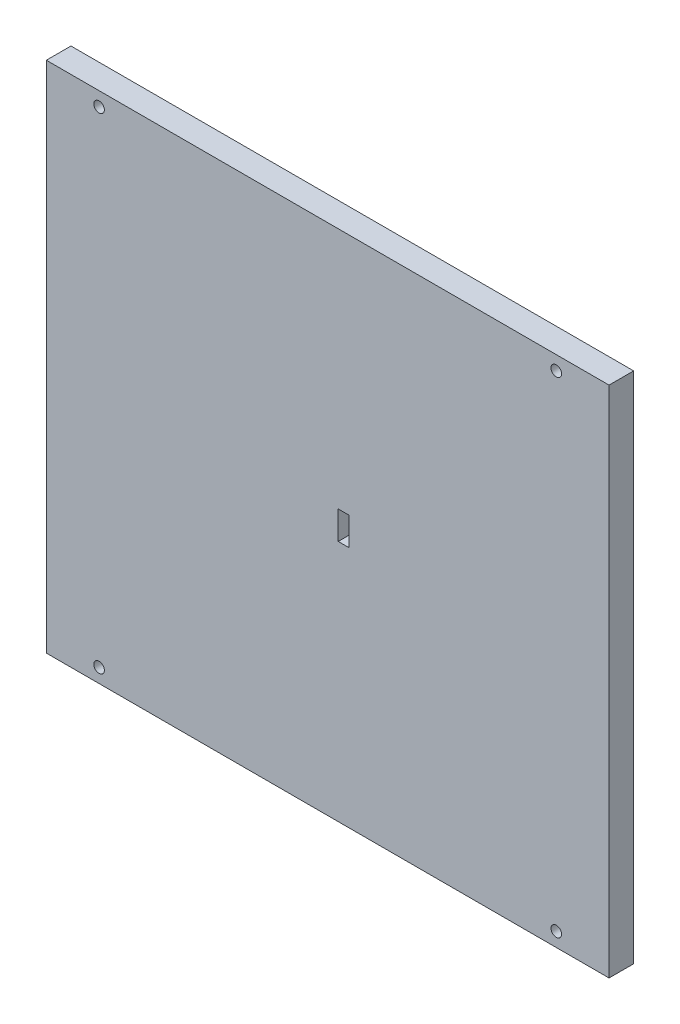
from build123d import *

# Parameters (mm, degrees)
SCHIZZO1_W                   = 160
SCHIZZO1_H                   = 146
SCHIZZO1_R                   = 1.5
ESTRUSIONE_ESTRUSIONE1_DEPTH = 7
SCHIZZO2_W                   = 35
SCHIZZO2_H                   = 24
SCHIZZO2_W_2                 = 23
SCHIZZO2_H_2                 = 12
ESTRUSIONE_ESTRUSIONE2_DEPTH = 13.5
SCHIZZO3_R                   = 1
TAGLIO_ESTRUSIONE1_DEPTH     = 5
SCHIZZO4_R                   = 40
SCHIZZO4_R_2                 = 36.5
ESTRUSIONE_ESTRUSIONE3_DEPTH = 28.5
RACCORDO1_R                  = 10
SCHIZZO5_W                   = 3
SCHIZZO5_H                   = 8
TAGLIO_ESTRUSIONE2_DEPTH     = 41


with BuildPart() as part:
    # Schizzo1 → Estrusione-Estrusione1 (new body)
    with BuildSketch(Plane.XY):
        with Locations((-3.483874863, 6.01)):
            Rectangle(SCHIZZO1_W, SCHIZZO1_H)
        with Locations((-68.483874863, 75.01)):
            Circle(SCHIZZO1_R, mode=Mode.SUBTRACT)
        with Locations((61.516125137, 75.01)):
            Circle(SCHIZZO1_R, mode=Mode.SUBTRACT)
        with Locations((-68.483874863, -62.99)):
            Circle(SCHIZZO1_R, mode=Mode.SUBTRACT)
        with Locations((61.516125137, -62.99)):
            Circle(SCHIZZO1_R, mode=Mode.SUBTRACT)
    extrude(amount=ESTRUSIONE_ESTRUSIONE1_DEPTH)

    # Schizzo2 → Estrusione-Estrusione2 (add)
    with BuildSketch(Plane(origin=(0, 0, 0), x_dir=(-1, 0, 0), z_dir=(0, 0, -1))):
        with Locations((8.983874863, 6.01)):
            Rectangle(SCHIZZO2_W, SCHIZZO2_H)
        with Locations((8.983874863, 6.01)):
            Rectangle(SCHIZZO2_W_2, SCHIZZO2_H_2, mode=Mode.SUBTRACT)
    extrude(amount=ESTRUSIONE_ESTRUSIONE2_DEPTH)

    # Schizzo3 → Taglio-Estrusione1 (cut)
    with BuildSketch(Plane(origin=(0, 0, -13.5), x_dir=(-1, 0, 0), z_dir=(0, 0, -1))):
        with Locations((22.733874863, 6.01)):
            Circle(SCHIZZO3_R)
        with Locations((-4.766125137, 6.01)):
            Circle(SCHIZZO3_R)
    extrude(amount=-TAGLIO_ESTRUSIONE1_DEPTH, mode=Mode.SUBTRACT)

    # Schizzo4 → Estrusione-Estrusione3 (add)
    with BuildSketch(Plane(origin=(0, 0, 0), x_dir=(-1, 0, 0), z_dir=(0, 0, -1))):
        with Locations((3.483874863, 6.01)):
            Circle(SCHIZZO4_R)
        with Locations((3.483874863, 6.01)):
            Circle(SCHIZZO4_R_2, mode=Mode.SUBTRACT)
    extrude(amount=ESTRUSIONE_ESTRUSIONE3_DEPTH)

    # Raccordo1
    raccordo1_edges = [part.edges().sort_by_distance(p)[0] for p in [
        (36.516125137, 6.01, 0),
    ]]
    fillet(raccordo1_edges, radius=RACCORDO1_R)

    # Schizzo5 → Taglio-Estrusione2 (cut)
    with BuildSketch(Plane(origin=(0, 0, 0), x_dir=(-1, 0, 0), z_dir=(0, 0, -1))):
        with Locations((-1.016125137, 6.01)):
            Rectangle(SCHIZZO5_W, SCHIZZO5_H)
    extrude(amount=-TAGLIO_ESTRUSIONE2_DEPTH, mode=Mode.SUBTRACT)


solid = part.part
